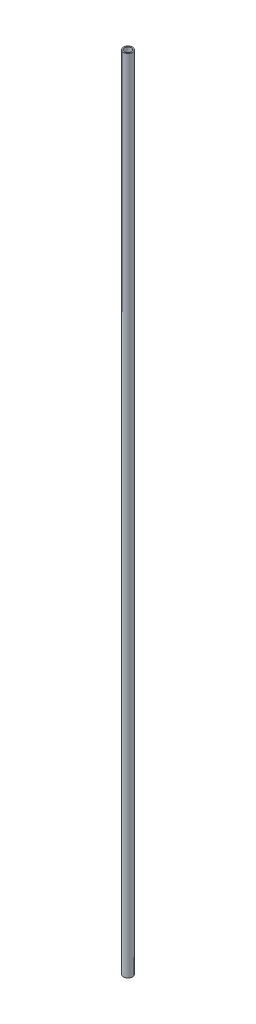
from build123d import *

# Parameters (mm, degrees)
SKETCH2_R   = 4
SKETCH2_R_2 = 3


with BuildPart() as part:
    # Sweep1: sweep along a path in Sketch1
    with BuildLine(Plane.XY) as sweep1_path:
        Line((0, 0), (0, 700))
    # Sketch2 → Sweep1 (sweep)
    with BuildSketch(Plane(origin=(0, 0, 0), x_dir=(1, 0, 0), z_dir=(0, 1, 0))):
        Circle(SKETCH2_R)
        Circle(SKETCH2_R_2, mode=Mode.SUBTRACT)
    sweep(path=sweep1_path.line)


solid = part.part
